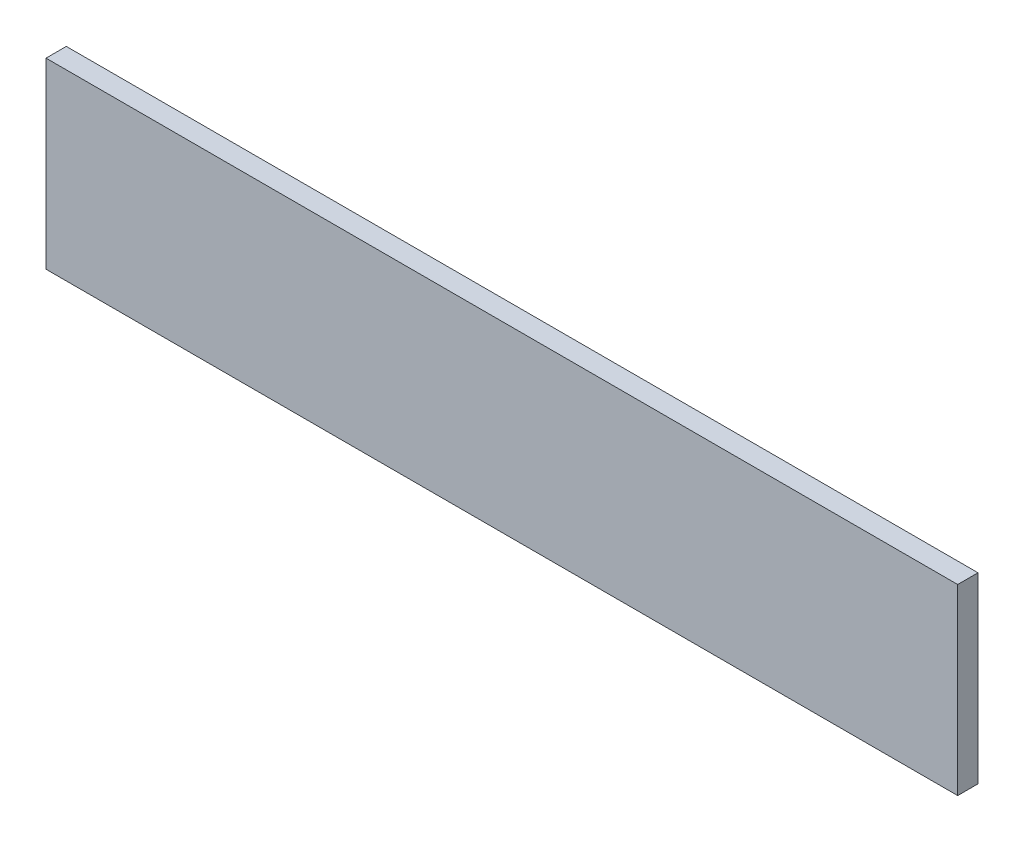
from build123d import *

# Parameters (mm, degrees)
SKETCH1_W           = 1139.952
SKETCH1_H           = 228.6
BOSS_EXTRUDE1_DEPTH = 12.7


with BuildPart() as part:
    # Sketch1 → Boss-Extrude1 (new, symmetric)
    with BuildSketch(Plane.XY):
        with Locations((569.976, 114.3)):
            Rectangle(SKETCH1_W, SKETCH1_H)
    extrude(amount=BOSS_EXTRUDE1_DEPTH, both=True)


solid = part.part
